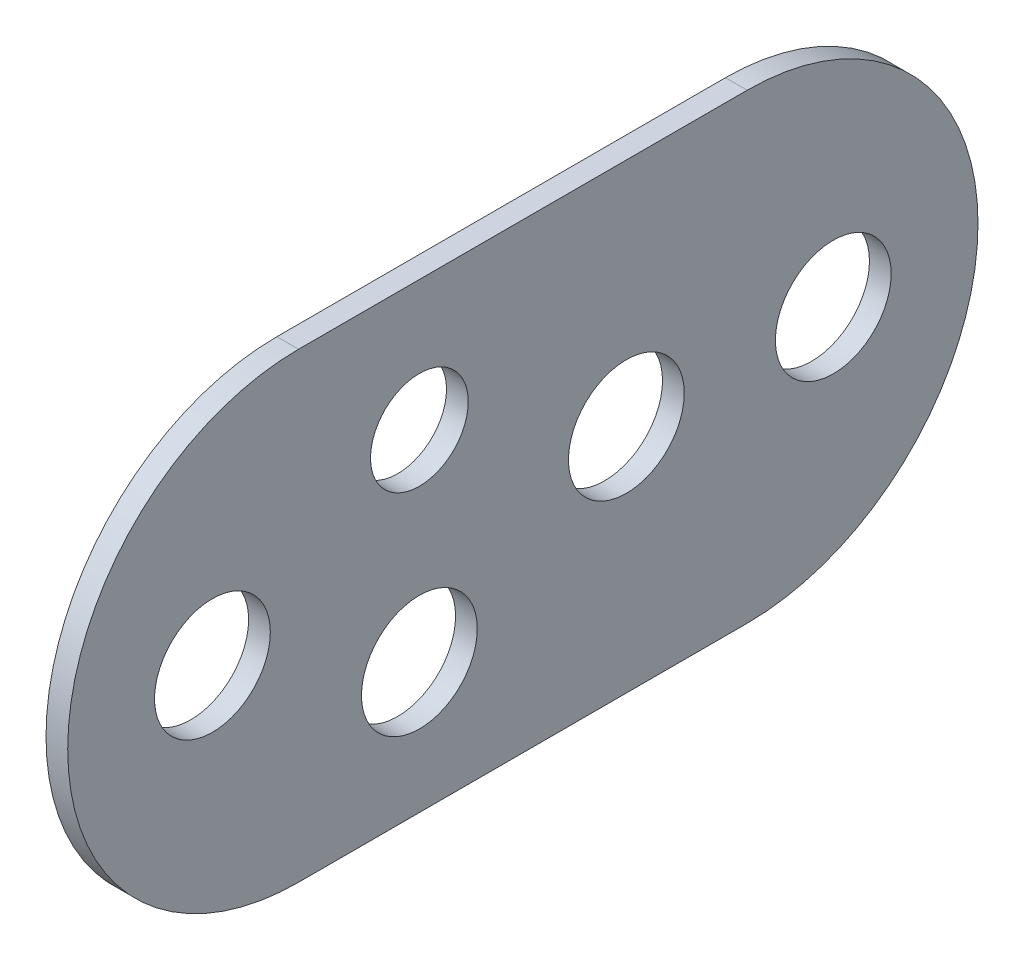
from build123d import *

# Parameters (mm, degrees)
BOSS_EXTRUDE1_DEPTH = 1.5
SKETCH2_R           = 8
SKETCH2_R_2         = 6.75
CUT_EXTRUDE1_DEPTH  = 71.590509277


with BuildPart() as part:
    # Sketch1 → Boss-Extrude1 (new, symmetric)
    with BuildSketch(Plane(origin=(0, 0, 0), x_dir=(0, 0, -1), z_dir=(1, 0, 0))):
        with BuildLine():
            Line((-31, 31.9), (31, 31.9))
            ThreePointArc((31, 31.9), (62.9, 0), (31, -31.9))
            Line((31, -31.9), (-31, -31.9))
            ThreePointArc((-31, -31.9), (-62.9, 0), (-31, 31.9))
        make_face()
    extrude(amount=BOSS_EXTRUDE1_DEPTH, both=True)

    # Sketch2 → Cut-Extrude1 (cut, through all)
    with BuildSketch(Plane(origin=(1.5, 0, 0), x_dir=(0, 0, -1), z_dir=(1, 0, 0))):
        with Locations((-42.9, 0)):
            Circle(SKETCH2_R)
        with Locations((42.9, 0)):
            Circle(SKETCH2_R)
        with Locations((-14.3, 13.9)):
            Circle(SKETCH2_R_2)
        with Locations((14.3, 0)):
            Circle(SKETCH2_R)
        with Locations((-14.3, -13.9)):
            Circle(SKETCH2_R)
    extrude(amount=-CUT_EXTRUDE1_DEPTH, mode=Mode.SUBTRACT)


solid = part.part
